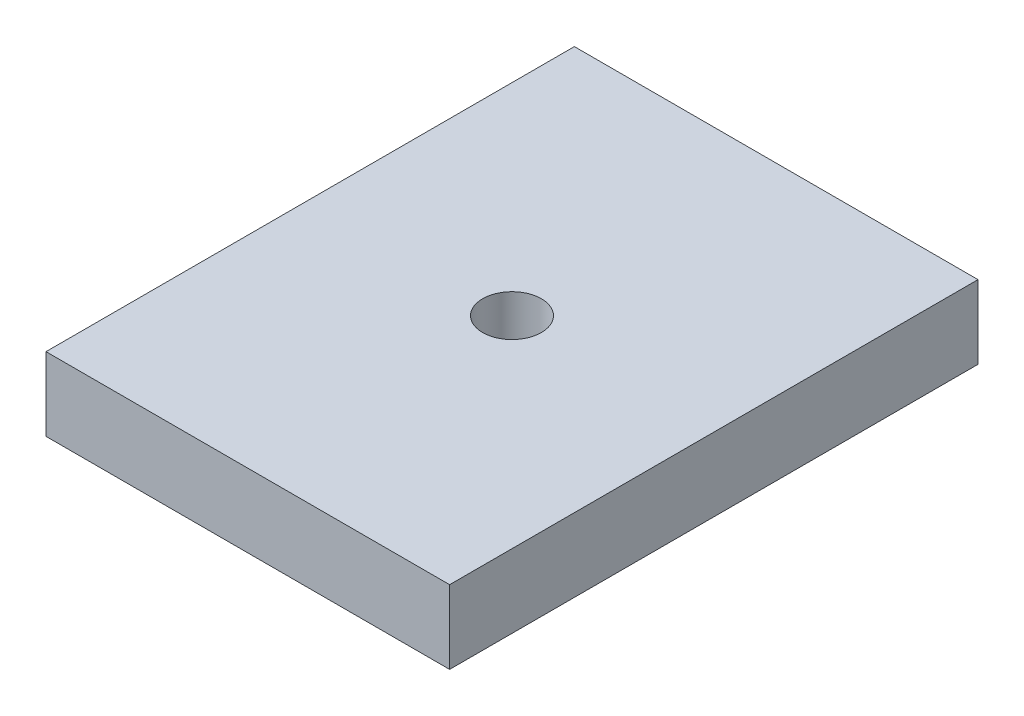
from build123d import *

# Parameters (mm, degrees)
SKETCH2_W           = 55.000077269
SKETCH2_H           = 72.000570089
SKETCH2_R           = 4
BOSS_EXTRUDE1_DEPTH = 10


with BuildPart() as part:
    # Sketch2 → Boss-Extrude1 (new body)
    with BuildSketch(Plane(origin=(0, 0, 0), x_dir=(1, 0, 0), z_dir=(0, 1, 0))):
        with Locations((-3.8635e-05, -0.000285044)):
            Rectangle(SKETCH2_W, SKETCH2_H)
        with Locations(Location((0, 0, 0), (0, 0, 270))):
            Circle(SKETCH2_R, mode=Mode.SUBTRACT)
    extrude(amount=BOSS_EXTRUDE1_DEPTH)


solid = part.part
